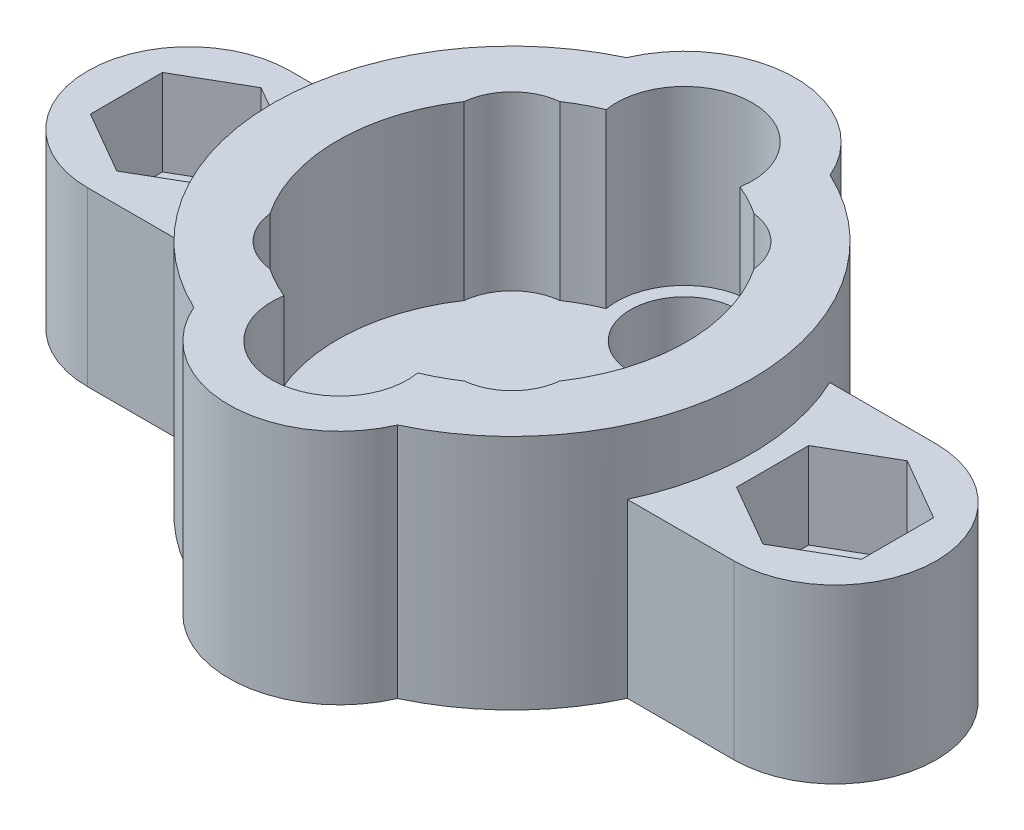
from build123d import *

# Parameters (mm, degrees)
SKETCH1_R           = 2.5
BOSS_EXTRUDE1_DEPTH = 3
BOSS_EXTRUDE2_DEPTH = 8
SKETCH4_R           = 1.7
BOSS_EXTRUDE3_DEPTH = 8
CUT_EXTRUDE1_DEPTH  = 4
SKETCH7_R           = 2.5
CUT_EXTRUDE2_DEPTH  = 10


with BuildPart() as part:
    # Sketch1 → Boss-Extrude1 (new body)
    with BuildSketch(Plane(origin=(0, 0, 0), x_dir=(1, 0, 0), z_dir=(0, 1, 0))):
        with BuildLine():
            ThreePointArc((4.727449491, 10.04296875), (0, 13.15), (-4.727449491, 10.04296875))
            ThreePointArc((-4.727449491, 10.04296875), (-11.1, 0), (-4.727449491, -10.04296875))
            ThreePointArc((-4.727449491, -10.04296875), (0, -13.15), (4.727449491, -10.04296875))
            ThreePointArc((4.727449491, -10.04296875), (11.1, 0), (4.727449491, 10.04296875))
        make_face()
        with Locations(Location((0, -8, 0), (0, 0, 270))):
            Circle(SKETCH1_R, mode=Mode.SUBTRACT)
        with Locations(Location((0, 8, 0), (0, 0, 270))):
            Circle(SKETCH1_R, mode=Mode.SUBTRACT)
    extrude(amount=BOSS_EXTRUDE1_DEPTH)

    # Sketch3 → Boss-Extrude2 (add)
    with BuildSketch(Plane(origin=(0, 3, 0), x_dir=(1, 0, 0), z_dir=(0, 1, 0))):
        with BuildLine():
            ThreePointArc((4.727449491, -10.04296875), (11.1, 0), (4.727449491, 10.04296875))
            ThreePointArc((4.727449491, 10.04296875), (0, 13.15), (-4.727449491, 10.04296875))
            ThreePointArc((-4.727449491, 10.04296875), (-11.1, 0), (-4.727449491, -10.04296875))
            ThreePointArc((-4.727449491, -10.04296875), (0, -13.15), (4.727449491, -10.04296875))
        make_face()
        with BuildLine():
            ThreePointArc((3.106861323, 7.48046875), (8.1, 0), (3.106861323, -7.48046875))
            ThreePointArc((3.106861323, -7.48046875), (0, -11.15), (-3.106861323, -7.48046875))
            ThreePointArc((-3.106861323, -7.48046875), (-8.1, 0), (-3.106861323, 7.48046875))
            ThreePointArc((-3.106861323, 7.48046875), (0, 11.15), (3.106861323, 7.48046875))
        make_face(mode=Mode.SUBTRACT)
    extrude(amount=BOSS_EXTRUDE2_DEPTH)

    # Sketch4 → Boss-Extrude3 (add)
    # profile 1 of 8: a face of its own
    with BuildSketch(Plane.XZ):
        with BuildLine():
            Line((10.055844072, -4.7), (15, -4.7))
            ThreePointArc((15, -4.7), (12.597919106, -4.039802889), (10.870666667, -2.244683992))
            ThreePointArc((10.870666667, -2.244683992), (10.53503, -3.496161166), (10.055844072, -4.7))
        make_face()
    # profile 2 of 8: a face of its own
    with BuildSketch(Plane.XZ):
        with BuildLine():
            ThreePointArc((10.870666667, 2.244683992), (12.597919106, 4.039802889), (15, 4.7))
            Line((15, 4.7), (10.055844072, 4.7))
            ThreePointArc((10.055844072, 4.7), (10.53503, 3.496161166), (10.870666667, 2.244683992))
        make_face()
    # profile 3 of 8: a face of its own
    with BuildSketch(Plane.XZ):
        with BuildLine():
            ThreePointArc((10.870666667, -2.244683992), (12.597919106, -4.039802889), (15, -4.7))
            ThreePointArc((15, -4.7), (18.323401872, -3.323401872), (19.7, 0))
            ThreePointArc((19.7, 0), (18.323401872, 3.323401872), (15, 4.7))
            ThreePointArc((15, 4.7), (12.597919106, 4.039802889), (10.870666667, 2.244683992))
            ThreePointArc((10.870666667, 2.244683992), (11.1, 0), (10.870666667, -2.244683992))
        make_face()
        with Locations(Location((15, 0, 0), (0, 0, 270))):
            Circle(SKETCH4_R, mode=Mode.SUBTRACT)
    # profile 4 of 8: a face of its own
    with BuildSketch(Plane.XZ):
        with BuildLine():
            ThreePointArc((-10.870666667, 2.244683992), (-12.597919106, 4.039802889), (-15, 4.7))
            ThreePointArc((-15, 4.7), (-19.7, 0), (-15, -4.7))
            ThreePointArc((-15, -4.7), (-12.597919106, -4.039802889), (-10.870666667, -2.244683992))
            ThreePointArc((-10.870666667, -2.244683992), (-11.1, 0), (-10.870666667, 2.244683992))
        make_face()
        with Locations(Location((-15, 0, 0), (0, 0, 270))):
            Circle(SKETCH4_R, mode=Mode.SUBTRACT)
    # profile 5 of 8: a face of its own
    with BuildSketch(Plane.XZ):
        with BuildLine():
            ThreePointArc((-10.870666667, -2.244683992), (-12.597919106, -4.039802889), (-15, -4.7))
            Line((-15, -4.7), (-10.055844072, -4.7))
            ThreePointArc((-10.055844072, -4.7), (-10.53503, -3.496161166), (-10.870666667, -2.244683992))
        make_face()
    # profile 6 of 8: a face of its own
    with BuildSketch(Plane.XZ):
        with BuildLine():
            Line((-10.055844072, 4.7), (-15, 4.7))
            ThreePointArc((-15, 4.7), (-12.597919106, 4.039802889), (-10.870666667, 2.244683992))
            ThreePointArc((-10.870666667, 2.244683992), (-10.53503, 3.496161166), (-10.055844072, 4.7))
        make_face()
    # profile 7 of 8: a face of its own
    with BuildSketch(Plane.XZ):
        with BuildLine():
            ThreePointArc((-10.3, 0), (-10.444900294, 1.158044328), (-10.870666667, 2.244683992))
            ThreePointArc((-10.870666667, 2.244683992), (-11.1, 0), (-10.870666667, -2.244683992))
            ThreePointArc((-10.870666667, -2.244683992), (-10.444900294, -1.158044328), (-10.3, 0))
        make_face()
    # profile 8 of 8: a face of its own
    with BuildSketch(Plane.XZ):
        with BuildLine():
            ThreePointArc((10.870666667, 2.244683992), (10.3, 0), (10.870666667, -2.244683992))
            ThreePointArc((10.870666667, -2.244683992), (11.1, 0), (10.870666667, 2.244683992))
        make_face()
    extrude(amount=-BOSS_EXTRUDE3_DEPTH)

    # Sketch5 → Cut-Extrude1 (cut)
    with BuildSketch(Plane(origin=(0, 8, 0), x_dir=(1, 0, 0), z_dir=(0, 1, 0))):
        Polygon((-15, -3.348631561), (-12.1, -1.674315781), (-12.1, 1.674315781), (-15, 3.348631561), (-17.9, 1.674315781), (-17.9, -1.674315781), align=None)
        Polygon((15, -3.348631561), (17.9, -1.674315781), (17.9, 1.674315781), (15, 3.348631561), (12.1, 1.674315781), (12.1, -1.674315781), align=None)
    extrude(amount=-CUT_EXTRUDE1_DEPTH, mode=Mode.SUBTRACT)

    # Sketch7 → Cut-Extrude2 (cut)
    with BuildSketch(Plane(origin=(0, 3, 0), x_dir=(1, 0, 0), z_dir=(0, 1, 0))):
        with Locations((4.242640687, 4.242640687)):
            Circle(SKETCH7_R)
        with Locations((4.242640687, -4.242640687)):
            Circle(SKETCH7_R)
        with Locations((-4.242640687, -4.242640687)):
            Circle(SKETCH7_R)
        with Locations((-4.242640687, 4.242640687)):
            Circle(SKETCH7_R)
    extrude(amount=CUT_EXTRUDE2_DEPTH, mode=Mode.SUBTRACT)


solid = part.part
